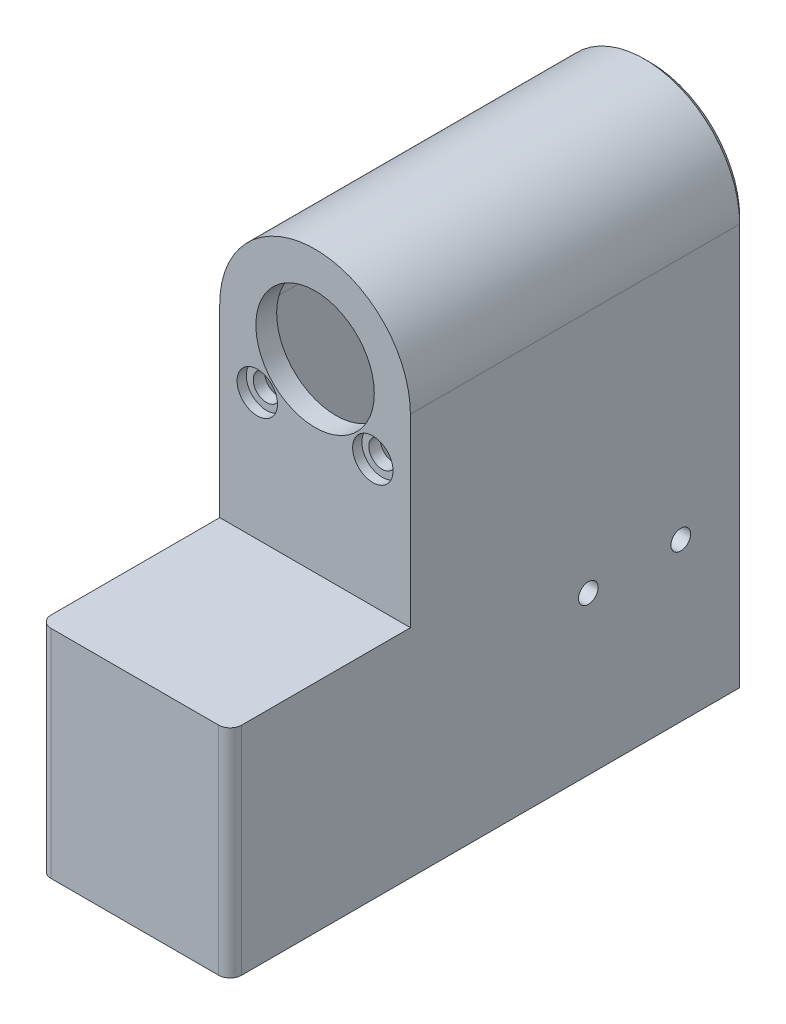
from build123d import *

# Parameters (mm, degrees)
SKETCH1_W                                      = 4
SKETCH1_H                                      = 80.5
BOSS_EXTRUDE1_DEPTH                            = 71
BOSS_EXTRUDE2_START                            = -4
BOSS_EXTRUDE2_DEPTH                            = 4
BOSS_EXTRUDE3_DEPTH                            = 34.2
CUT_EXTRUDE1_DEPTH                             = 13
CUT_EXTRUDE2_DEPTH                             = 13
SKETCH6_R                                      = 1.7
CUT_EXTRUDE3_DEPTH                             = 13
SKETCH7_R                                      = 3.25
CUT_EXTRUDE4_DEPTH                             = 2.5
BOSS_EXTRUDE4_DEPTH                            = 44.5
SKETCH10_W                                     = 46.002383675
SKETCH10_H                                     = 61.711229379
CUT_EXTRUDE5_DEPTH                             = 42
BOSS_EXTRUDE5_DEPTH                            = 4
CUT_EXTRUDE6_DEPTH                             = 10.6
CUT_EXTRUDE7_REACH                             = 148.85
SKETCH13_R                                     = 1.7
SKETCH14_W                                     = 25
SKETCH14_H                                     = 33.9
BOSS_EXTRUDE6_DEPTH                            = 1
CUT_EXTRUDE8_DEPTH                             = 15
SKETCH16_W                                     = 10.4
SKETCH16_H                                     = 1.3
CUT_EXTRUDE9_DEPTH                             = 15
POPUNIO_RUPU_DEPTH                             = 15
SKETCH18_W                                     = 33
SKETCH18_H                                     = 37.9
SASEKAO_ZA_TRI_MM_DEPTH                        = 3
SKETCH19_R                                     = 3.5
SKETCH19_R_2                                   = 3.25
POVE_AO_RUPE_ZA_ZAVRTNJE_DEPTH                 = 2.5
SKRATIO_DNO_DEPTH                              = 0.4
SKETCH21_W                                     = 25
SKETCH21_H                                     = 33.2
NAPRAVIO_MALO_VI_E_MESTA_ZA_VRH_RAZVODNI_DEPTH = 0.4
SKRATIO_CEONI_DEO_DEPTH                        = 0.4
NAPRAVIO_MESTA_ZA_DRZAC_1_REACH                = 137.848
SKETCH24_W                                     = 0.2
SKETCH24_H                                     = 33.9
NAPRAVIO_EMSTA_ZA_DRZAC_2_DEPTH                = 32.8
CHAMFER1_SIZE                                  = 1
SKETCH26_R                                     = 2.3
POVECAO_OTVOR_ZA_M3_DEPTH                      = 1.1
SKETCH27_R                                     = 10.25
POVECAO_OTVOR_ZA_PRIKLJUCAK_DEPTH              = 10
SKETCH28_W                                     = 25.4
SKETCH28_H                                     = 33.9
BOSS_EXTRUDE7_DEPTH                            = 2
ZAOBLJENJE_ZA_PRST_R                           = 2
OBORENA_IVICA_ZA_AKU_SIZE                      = 1
BOSS_EXTRUDE8_START                            = 0.9
SKETCH29_R                                     = 3.5
SKETCH29_R_2                                   = 2.3
BOSS_EXTRUDE8_DEPTH                            = 0.9
SKETCH30_R                                     = 3.5
CUT_EXTRUDE10_DEPTH                            = 2


with BuildPart() as part:
    # Sketch1 → Boss-Extrude1 (new body)
    with BuildSketch(Plane.XY):
        with Locations((2, 40.25)):
            Rectangle(SKETCH1_W, SKETCH1_H)
        with BuildLine():
            Line((0, 80.5), (4, 80.5))
            ThreePointArc((4, 80.5), (16.5, 93), (29, 80.5))
            Line((29, 80.5), (33, 80.5))
            ThreePointArc((33, 80.5), (16.5, 97), (0, 80.5))
        make_face()
        with Locations((31, 40.25)):
            Rectangle(SKETCH1_W, SKETCH1_H)
    extrude(amount=BOSS_EXTRUDE1_DEPTH)

    # Sketch2 → Boss-Extrude2 (add)
    with BuildSketch(Plane.XY.offset(71).offset(BOSS_EXTRUDE2_START)):
        with BuildLine():
            Line((33, 48.5), (0, 48.5))
            Line((0, 48.5), (0, 80.5))
            ThreePointArc((0, 80.5), (16.5, 97), (33, 80.5))
            Line((33, 80.5), (33, 48.5))
        make_face()
    extrude(amount=BOSS_EXTRUDE2_DEPTH)

    # Sketch3 → Boss-Extrude3 (add)
    with BuildSketch(Plane(origin=(0, 0, 67), x_dir=(-1, 0, 0), z_dir=(0, 0, -1))):
        Polygon((-33, 0), (-33, 48.5), (-29, 48.5), (-4, 48.5), (0, 48.5), (0, 0), (-3.837905566, 0), (-4, 44.5), (-29, 44.5), (-29.162094434, 0), align=None)
    extrude(amount=-BOSS_EXTRUDE3_DEPTH)

    # Sketch4 → Cut-Extrude1 (cut)
    with BuildSketch(Plane(origin=(0, 0, 0), x_dir=(-1, 0, 0), z_dir=(0, 0, -1))):
        with BuildLine():
            Line((-4, 80.5), (-4, 0))
            Line((-4, 0), (0, 0))
            Line((0, 0), (0, 80.5))
            ThreePointArc((0, 80.5), (-16.5, 97), (-33, 80.5))
            Line((-33, 80.5), (-33, 0))
            Line((-33, 0), (-29, 0))
            Line((-29, 0), (-29, 80.5))
            ThreePointArc((-29, 80.5), (-16.5, 93), (-4, 80.5))
        make_face()
    extrude(amount=-CUT_EXTRUDE1_DEPTH, mode=Mode.SUBTRACT)

    # Sketch5 → Cut-Extrude2 (cut)
    with BuildSketch(Plane.XY.offset(71)):
        with BuildLine():
            ThreePointArc((26.5, 80.5), (16.5, 90.5), (6.5, 80.5))
            Line((6.5, 80.5), (26.5, 80.5))
        make_face()
        with BuildLine():
            Line((26.5, 80.5), (6.5, 80.5))
            ThreePointArc((6.5, 80.5), (16.5, 70.5), (26.5, 80.5))
        make_face()
    extrude(amount=-CUT_EXTRUDE2_DEPTH, mode=Mode.SUBTRACT)

    # Sketch6 → Cut-Extrude3 (cut)
    with BuildSketch(Plane.XY.offset(71)):
        with Locations((6.5, 70.5)):
            Circle(SKETCH6_R)
        with BuildLine():
            ThreePointArc((28.2, 70.5), (26.5, 72.2), (24.8, 70.5))
            Line((24.8, 70.5), (28.2, 70.5))
        make_face()
        with BuildLine():
            Line((28.2, 70.5), (24.8, 70.5))
            ThreePointArc((24.8, 70.5), (26.5, 68.8), (28.2, 70.5))
        make_face()
    extrude(amount=-CUT_EXTRUDE3_DEPTH, mode=Mode.SUBTRACT)

    # Sketch7 → Cut-Extrude4 (cut)
    with BuildSketch(Plane.XY.offset(71)):
        with Locations((6.5, 70.5)):
            Circle(SKETCH7_R)
        with Locations((26.5, 70.5)):
            Circle(SKETCH7_R)
    extrude(amount=-CUT_EXTRUDE4_DEPTH, mode=Mode.SUBTRACT)

    # Sketch9 → Boss-Extrude4 (add)
    with BuildSketch(Plane.XZ):
        Polygon((29.162094434, 101.2), (29.162094434, 71), (29, 71), (29, 120), align=None)
        Polygon((4, 120), (3.837905566, 101.2), (3.837905566, 71), (4, 71), align=None)
    extrude(amount=-BOSS_EXTRUDE4_DEPTH)

    # Sketch10 → Cut-Extrude5 (cut)
    with BuildSketch(Plane.XY.offset(101.2)):
        with Locations((17.24268837, 24.291112106)):
            Rectangle(SKETCH10_W, SKETCH10_H)
    extrude(amount=CUT_EXTRUDE5_DEPTH, mode=Mode.SUBTRACT)

    # Sketch11 → Boss-Extrude5 (add)
    with BuildSketch(Plane.XY.offset(101.2)):
        Polygon((29, 0), (4, 0), (0, 0), (0, 48.5), (33, 48.5), (33, 0), align=None)
    extrude(amount=BOSS_EXTRUDE5_DEPTH)

    # Sketch12 → Cut-Extrude6 (cut)
    with BuildSketch(Plane.XZ):
        Polygon((4, 13), (4, 101.2), (29, 101.2), (29, 13), (33, 13), (33, 105.2), (0, 105.2), (0, 13), align=None)
    extrude(amount=-CUT_EXTRUDE6_DEPTH, mode=Mode.SUBTRACT)

    # Cut-Extrude7: up to this face of the body (flat: up to its plane)
    cut_extrude7_end = Plane(part.part.faces().sort_by_distance((33, 41.673849147, 53.168159645))[0])
    # Sketch13 → Cut-Extrude7 (cut, up to the picked face)
    with BuildSketch(Plane.ZY, mode=Mode.PRIVATE) as cut_extrude7_sk1:
        with Locations((40.2, 38.3)):
            Circle(SKETCH13_R)
    cut_extrude7_tool1 = split(extrude(cut_extrude7_sk1.sketch, amount=-CUT_EXTRUDE7_REACH, mode=Mode.PRIVATE), bisect_by=cut_extrude7_end, keep=Keep.BOTH, mode=Mode.PRIVATE)
    # Sketch13 → Cut-Extrude7 (cut, up to the picked face)
    with BuildSketch(Plane.ZY, mode=Mode.PRIVATE) as cut_extrude7_sk2:
        with Locations((24.2, 38.3)):
            Circle(SKETCH13_R)
    cut_extrude7_tool2 = split(extrude(cut_extrude7_sk2.sketch, amount=-CUT_EXTRUDE7_REACH, mode=Mode.PRIVATE), bisect_by=cut_extrude7_end, keep=Keep.BOTH, mode=Mode.PRIVATE)
    add(cut_extrude7_tool1.solids().sort_by(Axis((0, 38.3, 40.2), (1, 0, 0)))[0], mode=Mode.SUBTRACT)
    add(cut_extrude7_tool2.solids().sort_by(Axis((0, 38.3, 24.2), (1, 0, 0)))[0], mode=Mode.SUBTRACT)

    # Sketch14 → Boss-Extrude6 (add)
    with BuildSketch(Plane(origin=(0, 0, 101.2), x_dir=(-1, 0, 0), z_dir=(0, 0, -1))):
        with Locations((-16.5, 27.55)):
            Rectangle(SKETCH14_W, SKETCH14_H)
    extrude(amount=BOSS_EXTRUDE6_DEPTH)

    # Sketch15 → Cut-Extrude8 (cut)
    with BuildSketch(Plane.XZ.offset(-10.6)):
        Polygon((26.7, 103.9), (6.3, 103.9), (6.3, 101.5), (16.5, 101.5), (26.7, 101.5), align=None)
    extrude(amount=-CUT_EXTRUDE8_DEPTH, mode=Mode.SUBTRACT)

    # Sketch16 → Cut-Extrude9 (cut)
    with BuildSketch(Plane.XZ.offset(-10.6)):
        with Locations((16.5, 104.55)):
            Rectangle(SKETCH16_W, SKETCH16_H)
    extrude(amount=-CUT_EXTRUDE9_DEPTH, mode=Mode.SUBTRACT)

    # Sketch17 → popunio rupu (add)
    with BuildSketch(Plane.XZ.offset(-25.6)):
        Polygon((26.7, 103.9), (21.7, 103.9), (21.7, 105.2), (11.3, 105.2), (11.3, 103.9), (6.3, 103.9), (6.3, 101.5), (26.7, 101.5), align=None)
    extrude(amount=POPUNIO_RUPU_DEPTH)

    # Sketch18 → sasekao za tri mm (cut)
    with BuildSketch(Plane.XY.offset(105.2)):
        with Locations((16.5, 29.55)):
            Rectangle(SKETCH18_W, SKETCH18_H)
    extrude(amount=-SASEKAO_ZA_TRI_MM_DEPTH, mode=Mode.SUBTRACT)

    # Sketch19 → pove'ao rupe za zavrtnje (cut)
    # profile 1 of 2: a face of its own
    with BuildSketch(Plane.XY.offset(71)):
        with Locations((6.5, 70.5)):
            Circle(SKETCH19_R)
        with Locations((6.5, 70.5)):
            Circle(SKETCH19_R_2, mode=Mode.SUBTRACT)
    # profile 2 of 2: a face of its own
    with BuildSketch(Plane.XY.offset(71)):
        with Locations((26.5, 70.5)):
            Circle(SKETCH19_R)
    extrude(amount=-POVE_AO_RUPE_ZA_ZAVRTNJE_DEPTH, mode=Mode.SUBTRACT)

    # Sketch20 → skratio dno (cut)
    with BuildSketch(Plane.XZ.offset(-10.6)):
        Polygon((33, 13), (33, 102.2), (0, 102.2), (0, 13), (4, 13), (4, 100.2), (29, 100.2), (29, 13), align=None)
    extrude(amount=-SKRATIO_DNO_DEPTH, mode=Mode.SUBTRACT)

    # Sketch21 → napravio malo vi[e mesta za vrh razvodnika (cut)
    with BuildSketch(Plane.XZ.offset(-44.5)):
        with Locations((16.5, 83.6)):
            Rectangle(SKETCH21_W, SKETCH21_H)
    extrude(amount=-NAPRAVIO_MALO_VI_E_MESTA_ZA_VRH_RAZVODNI_DEPTH, mode=Mode.SUBTRACT)

    # Sketch22 → skratio ceoni deo (cut)
    with BuildSketch(Plane(origin=(0, 0, 67), x_dir=(-1, 0, 0), z_dir=(0, 0, -1))):
        with BuildLine():
            Line((-29, 44.9), (-4, 44.9))
            Line((-4, 44.9), (-4, 80.5))
            ThreePointArc((-4, 80.5), (-16.5, 93), (-29, 80.5))
            Line((-29, 80.5), (-29, 44.9))
        make_face()
    extrude(amount=-SKRATIO_CEONI_DEO_DEPTH, mode=Mode.SUBTRACT)

    # napravio mesta za drzac 1: up to this face of the body (flat: up to its plane)
    napravio_mesta_za_drzac_1_end = Plane(part.part.faces().sort_by_distance((16.5, 62.621792599, 67.4))[0])
    # Sketch23 → napravio mesta za drzac 1 (cut, up to the picked face)
    with BuildSketch(Plane(origin=(0, 0, 13), x_dir=(-1, 0, 0), z_dir=(0, 0, -1)), mode=Mode.PRIVATE) as napravio_mesta_za_drzac_1_sk1:
        with BuildLine():
            Line((-29, 80.5), (-29, 11))
            Line((-29, 11), (-29.2, 11))
            Line((-29.2, 11), (-29.2, 80.5))
            ThreePointArc((-29.2, 80.5), (-16.5, 93.2), (-3.8, 80.5))
            Line((-3.8, 80.5), (-3.8, 11))
            Line((-3.8, 11), (-4, 11))
            Line((-4, 11), (-4, 80.5))
            ThreePointArc((-4, 80.5), (-16.5, 93), (-29, 80.5))
        make_face()
    napravio_mesta_za_drzac_1_tool1 = split(extrude(napravio_mesta_za_drzac_1_sk1.sketch, amount=-NAPRAVIO_MESTA_ZA_DRZAC_1_REACH, mode=Mode.PRIVATE), bisect_by=napravio_mesta_za_drzac_1_end, keep=Keep.BOTH, mode=Mode.PRIVATE)
    add(napravio_mesta_za_drzac_1_tool1.solids().sort_by(Axis((16.5, 93.113965, 13), (0, 0, 1)))[0], mode=Mode.SUBTRACT)

    # Sketch24 → napravio emsta za drzac 2 (cut)
    with BuildSketch(Plane(origin=(0, 0, 67.4), x_dir=(-1, 0, 0), z_dir=(0, 0, -1))):
        with Locations((-3.9, 27.95)):
            Rectangle(SKETCH24_W, SKETCH24_H)
        with Locations((-29.1, 27.95)):
            Rectangle(SKETCH24_W, SKETCH24_H)
    extrude(amount=-NAPRAVIO_EMSTA_ZA_DRZAC_2_DEPTH, mode=Mode.SUBTRACT)

    # Chamfer1
    chamfer1_edges = [part.edges().sort_by_distance(p)[0] for p in [
        (1.9, 11, 13),
        (31.1, 11, 13),
    ]]
    chamfer(chamfer1_edges, length=CHAMFER1_SIZE)

    # Sketch26 → povecao otvor za M3 (cut)
    with BuildSketch(Plane.XY.offset(68.5)):
        with Locations((26.5, 70.5)):
            Circle(SKETCH26_R)
        with Locations((6.5, 70.5)):
            Circle(SKETCH26_R)
    extrude(amount=-POVECAO_OTVOR_ZA_M3_DEPTH, mode=Mode.SUBTRACT)

    # Sketch27 → povecao otvor za prikljucak (cut)
    with BuildSketch(Plane.XY.offset(71)):
        with Locations((16.5, 80.5)):
            Circle(SKETCH27_R)
    extrude(amount=-POVECAO_OTVOR_ZA_PRIKLJUCAK_DEPTH, mode=Mode.SUBTRACT)

    # Sketch28 → Boss-Extrude7 (add)
    with BuildSketch(Plane(origin=(0, 0, 100.2), x_dir=(-1, 0, 0), z_dir=(0, 0, -1))):
        with Locations((-16.5, 27.95)):
            Rectangle(SKETCH28_W, SKETCH28_H)
    extrude(amount=BOSS_EXTRUDE7_DEPTH)

    # zaobljenje za prst
    zaobljenje_za_prst_edges = [part.edges().sort_by_distance(p)[0] for p in [
        (0, 29.75, 102.2),
        (33, 29.75, 102.2),
        (3.8, 27.95, 98.2),
        (29.2, 27.95, 98.2),
    ]]
    fillet(zaobljenje_za_prst_edges, radius=ZAOBLJENJE_ZA_PRST_R)

    # oborena ivica za šaku
    oborena_ivica_za_aku_edges = [part.edges().sort_by_distance(p)[0] for p in [
        (0, 46.25, 13),
        (16.5, 97, 13),
        (33, 46.25, 13),
    ]]
    chamfer(oborena_ivica_za_aku_edges, length=OBORENA_IVICA_ZA_AKU_SIZE)

    # Sketch29 → Boss-Extrude8 (add)
    # profile 1 of 2: a face of its own
    with BuildSketch(Plane.XY.offset(68.5).offset(BOSS_EXTRUDE8_START)):
        with Locations((6.5, 70.5)):
            Circle(SKETCH29_R)
        with Locations((6.5, 70.5)):
            Circle(SKETCH29_R_2, mode=Mode.SUBTRACT)
    # profile 2 of 2: a face of its own
    with BuildSketch(Plane.XY.offset(68.5).offset(BOSS_EXTRUDE8_START)):
        with Locations((26.5, 70.5)):
            Circle(SKETCH29_R)
        with Locations((26.5, 70.5)):
            Circle(SKETCH29_R_2, mode=Mode.SUBTRACT)
    extrude(amount=-BOSS_EXTRUDE8_DEPTH)

    # Sketch30 → Cut-Extrude10 (cut)
    with BuildSketch(Plane.ZY):
        with Locations((24.2, 38.3)):
            Circle(SKETCH30_R)
        with Locations((40.2, 38.3)):
            Circle(SKETCH30_R)
    extrude(amount=-CUT_EXTRUDE10_DEPTH, mode=Mode.SUBTRACT)


solid = part.part
